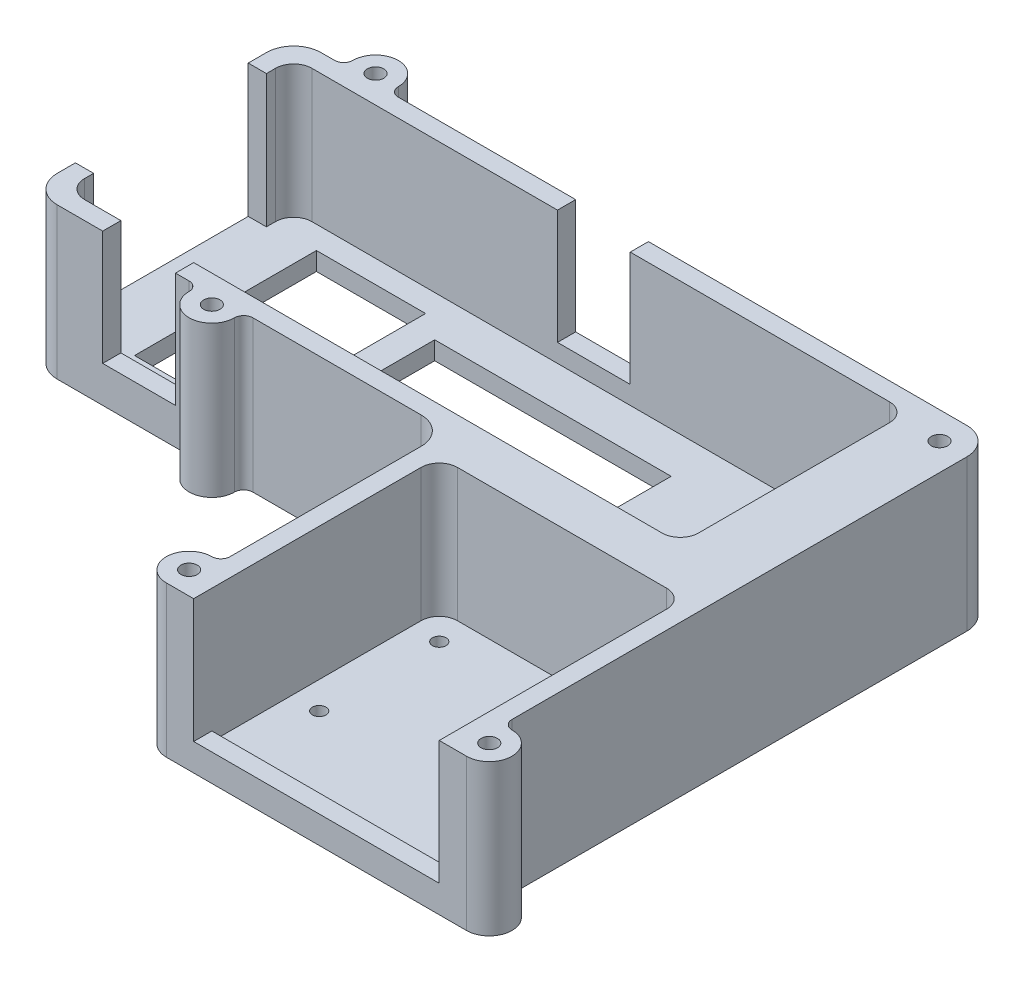
from build123d import *

# Parameters (mm, degrees)
CROQUIS1_W              = 12
CROQUIS1_H              = 20
CROQUIS1_W_2            = 26
CROQUIS1_H_2            = 16
SALIENTE_EXTRUIR1_DEPTH = 2
CROQUIS2_W              = 27
CROQUIS2_H              = 25
SALIENTE_EXTRUIR2_DEPTH = 14.6
CROQUIS3_W              = 27
CROQUIS3_H              = 13.6
CORTAR_EXTRUIR1_DEPTH   = 2
REDONDEO1_R             = 3
REDONDEO2_R             = 2
CROQUIS4_W              = 8
CROQUIS4_H              = 12.6
CORTAR_EXTRUIR2_DEPTH   = 2
CROQUIS5_W              = 8
CROQUIS5_H              = 12.6
CORTAR_EXTRUIR3_DEPTH   = 2
CROQUIS6_R              = 0.75
CORTAR_EXTRUIR4_DEPTH   = 2
CROQUIS7_R              = 0.9
SALIENTE_EXTRUIR3_DEPTH = 16.6
CROQUIS8_R              = 0.9
CORTAR_EXTRUIR5_DEPTH   = 6


with BuildPart() as part:
    # Croquis1 → Saliente-Extruir1 (new body)
    with BuildSketch(Plane(origin=(0, 0, 0), x_dir=(1, 0, 0), z_dir=(0, 1, 0))):
        Polygon((31, 29), (31, -30), (0, -30), (0, 0), (-46, 0), (-46, 29), align=None)
        with Locations((-33, 14.5)):
            Rectangle(CROQUIS1_W, CROQUIS1_H, mode=Mode.SUBTRACT)
        with Locations((-11, 14.5)):
            Rectangle(CROQUIS1_W_2, CROQUIS1_H_2, mode=Mode.SUBTRACT)
    extrude(amount=SALIENTE_EXTRUIR1_DEPTH)

    # Croquis2 → Saliente-Extruir2 (add)
    with BuildSketch(Plane(origin=(0, 2, 0), x_dir=(1, 0, 0), z_dir=(0, 1, 0))):
        Polygon((0, -30), (31, -30), (31, 29), (-46, 29), (-46, 24), (-44, 24), (-44, 27), (23.5, 27), (23.5, 2), (-44, 2), (-44, 5), (-46, 5), (-46, 0), (0, 0), align=None)
        with Locations((15.5, -15.5)):
            Rectangle(CROQUIS2_W, CROQUIS2_H, mode=Mode.SUBTRACT)
    extrude(amount=SALIENTE_EXTRUIR2_DEPTH)

    # Croquis3 → Cortar-Extruir1 (cut)
    with BuildSketch(Plane.XY.offset(30)):
        with Locations((15.5, 9.8)):
            Rectangle(CROQUIS3_W, CROQUIS3_H)
    extrude(amount=-CORTAR_EXTRUIR1_DEPTH, mode=Mode.SUBTRACT)

    # Redondeo1
    redondeo1_edges = [part.edges().sort_by_distance(p)[0] for p in [
        (0, 8.3, 0),
        (-46, 8.3, 0),
        (-46, 8.3, -29),
        (31, 8.3, -29),
    ]]
    fillet(redondeo1_edges, radius=REDONDEO1_R)

    # Redondeo2
    redondeo2_edges = [part.edges().sort_by_distance(p)[0] for p in [
        (-44, 9.3, -27),
        (23.5, 9.3, -27),
        (23.5, 9.3, -2),
        (-44, 9.3, -2),
        (29, 9.3, 3),
        (2, 9.3, 3),
    ]]
    fillet(redondeo2_edges, radius=REDONDEO2_R)

    # Croquis4 → Cortar-Extruir2 (cut)
    with BuildSketch(Plane.XY):
        with Locations((-34, 10.3)):
            Rectangle(CROQUIS4_W, CROQUIS4_H)
    extrude(amount=-CORTAR_EXTRUIR2_DEPTH, mode=Mode.SUBTRACT)

    # Croquis5 → Cortar-Extruir3 (cut)
    with BuildSketch(Plane(origin=(0, 0, -29), x_dir=(-1, 0, 0), z_dir=(0, 0, -1))):
        with Locations((11, 10.3)):
            Rectangle(CROQUIS5_W, CROQUIS5_H)
    extrude(amount=-CORTAR_EXTRUIR3_DEPTH, mode=Mode.SUBTRACT)

    # Croquis6 → Cortar-Extruir4 (cut)
    with BuildSketch(Plane(origin=(0, 2, 0), x_dir=(1, 0, 0), z_dir=(0, 1, 0))):
        with Locations(Location((26, -6, 0), (0, 0, 270))):
            Circle(CROQUIS6_R)
        with Locations(Location((5, -6, 0), (0, 0, 270))):
            Circle(CROQUIS6_R)
        with Locations(Location((5, -19.2, 0), (0, 0, 270))):
            Circle(CROQUIS6_R)
        with Locations(Location((26, -19.2, 0), (0, 0, 270))):
            Circle(CROQUIS6_R)
    extrude(amount=-CORTAR_EXTRUIR4_DEPTH, mode=Mode.SUBTRACT)

    # Croquis7 → Saliente-Extruir3 (add)
    # profile 1 of 4: a face of its own
    with BuildSketch(Plane(origin=(0, 16.6, 0), x_dir=(1, 0, 0), z_dir=(0, 1, 0))):
        with BuildLine():
            Line((31, -30), (31, -24))
            ThreePointArc((31, -24), (31.292893219, -24.707106781), (32, -25))
            ThreePointArc((32, -25), (34.5, -27.5), (32, -30))
            Line((32, -30), (31, -30))
        make_face()
        with Locations(Location((32, -27.5, 0), (0, 0, 270))):
            Circle(CROQUIS7_R, mode=Mode.SUBTRACT)
    # profile 2 of 4: a face of its own
    with BuildSketch(Plane(origin=(0, 16.6, 0), x_dir=(1, 0, 0), z_dir=(0, 1, 0))):
        with BuildLine():
            Line((-1, -30), (0, -30))
            Line((0, -30), (0, -24))
            ThreePointArc((0, -24), (-0.292893219, -24.707106781), (-1, -25))
            ThreePointArc((-1, -25), (-3.5, -27.5), (-1, -30))
        make_face()
        with Locations(Location((-1, -27.5, 0), (0, 0, 90))):
            Circle(CROQUIS7_R, mode=Mode.SUBTRACT)
    # profile 3 of 4: a face of its own
    with BuildSketch(Plane(origin=(0, 16.6, 0), x_dir=(1, 0, 0), z_dir=(0, 1, 0))):
        with BuildLine():
            Line((-34.5, 29), (-41.5, 29))
            ThreePointArc((-41.5, 29), (-40.792893219, 29.292893219), (-40.5, 30))
            ThreePointArc((-40.5, 30), (-38, 32.5), (-35.5, 30))
            ThreePointArc((-35.5, 30), (-35.207106781, 29.292893219), (-34.5, 29))
        make_face()
        with Locations(Location((-38, 30, 0), (0, 0, 270))):
            Circle(CROQUIS7_R, mode=Mode.SUBTRACT)
    # profile 4 of 4: a face of its own
    with BuildSketch(Plane(origin=(0, 16.6, 0), x_dir=(1, 0, 0), z_dir=(0, 1, 0))):
        with BuildLine():
            Line((-21.5, 0), (-28.5, 0))
            ThreePointArc((-28.5, 0), (-27.792893219, -0.292893219), (-27.5, -1))
            ThreePointArc((-27.5, -1), (-25, -3.5), (-22.5, -1))
            ThreePointArc((-22.5, -1), (-22.207106781, -0.292893219), (-21.5, 0))
        make_face()
        with Locations(Location((-25, -1, 0), (0, 0, 90))):
            Circle(CROQUIS7_R, mode=Mode.SUBTRACT)
    extrude(amount=-SALIENTE_EXTRUIR3_DEPTH)

    # Croquis8 → Cortar-Extruir5 (cut)
    with BuildSketch(Plane(origin=(0, 16.6, 0), x_dir=(1, 0, 0), z_dir=(0, 1, 0))):
        with Locations(Location((28, 26, 0), (0, 0, 270))):
            Circle(CROQUIS8_R)
    extrude(amount=-CORTAR_EXTRUIR5_DEPTH, mode=Mode.SUBTRACT)


solid = part.part
